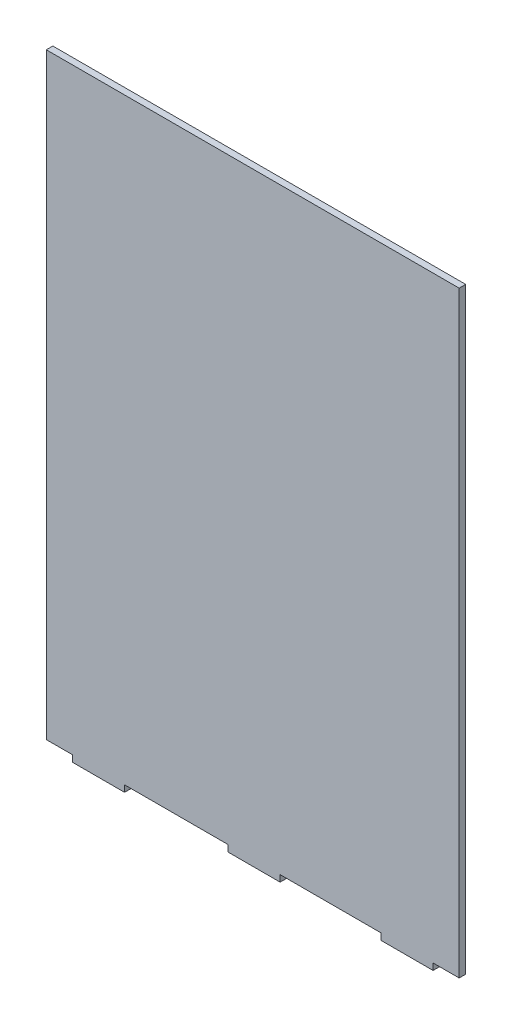
from build123d import *

# Parameters (mm, degrees)
BOSS_EXTRUDE1_DEPTH = 3.175


with BuildPart() as part:
    # Sketch1 → Boss-Extrude1 (new body)
    with BuildSketch(Plane.XY):
        Polygon((0, 0), (12.7, 0), (12.7, -3.175), (38.1, -3.175), (38.1, 0), (88.415370865, 0), (88.415370865, -3.175), (113.815370865, -3.175), (113.815370865, 0), (162.88004, 0), (162.88004, -3.175), (188.28004, -3.175), (188.28004, 0), (200.98004, 0), (200.98004, 290.83), (0, 290.83), align=None)
    extrude(amount=BOSS_EXTRUDE1_DEPTH)


solid = part.part
